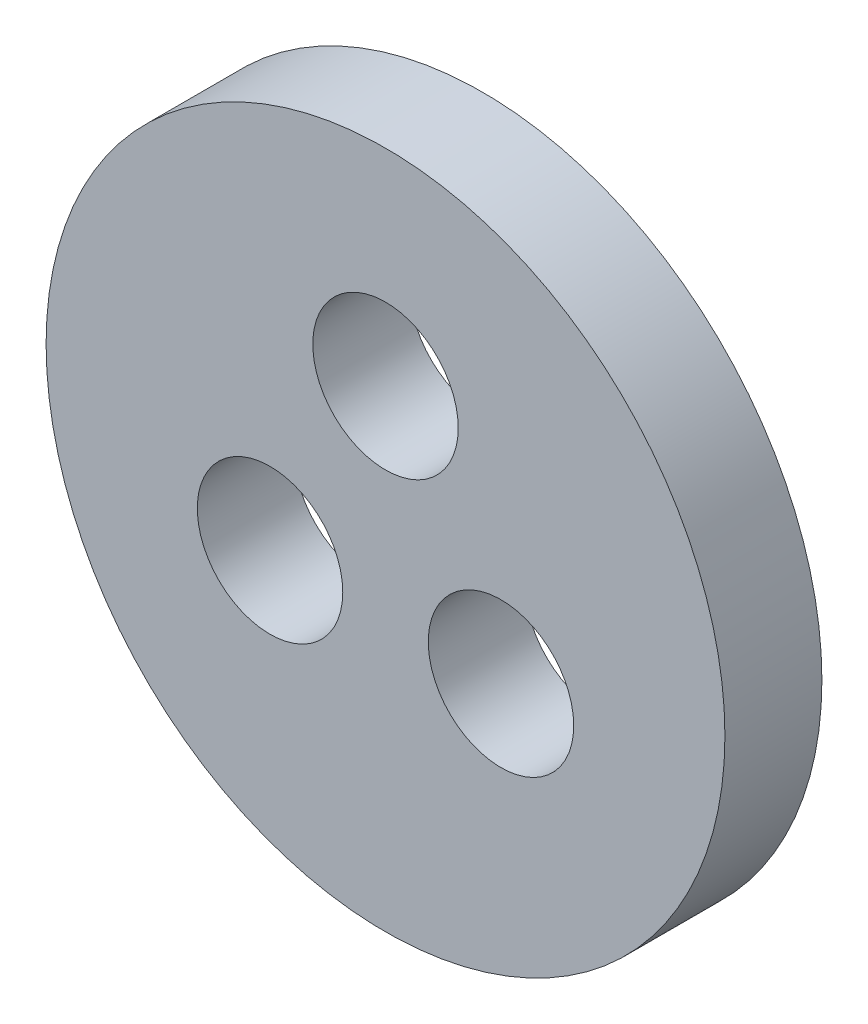
from build123d import *

# Parameters (mm, degrees)
SKETCH1_R           = 11.1125
SKETCH1_R_2         = 2.38125
BOSS_EXTRUDE1_DEPTH = 3.175


with BuildPart() as part:
    # Sketch1 → Boss-Extrude1 (new body)
    with BuildSketch(Plane.XY):
        Circle(SKETCH1_R)
        with Locations((0, 4.365625)):
            Circle(SKETCH1_R_2, mode=Mode.SUBTRACT)
        with Locations((3.780742153, -2.1828125)):
            Circle(SKETCH1_R_2, mode=Mode.SUBTRACT)
        with Locations((-3.780742153, -2.1828125)):
            Circle(SKETCH1_R_2, mode=Mode.SUBTRACT)
    extrude(amount=BOSS_EXTRUDE1_DEPTH)


solid = part.part
